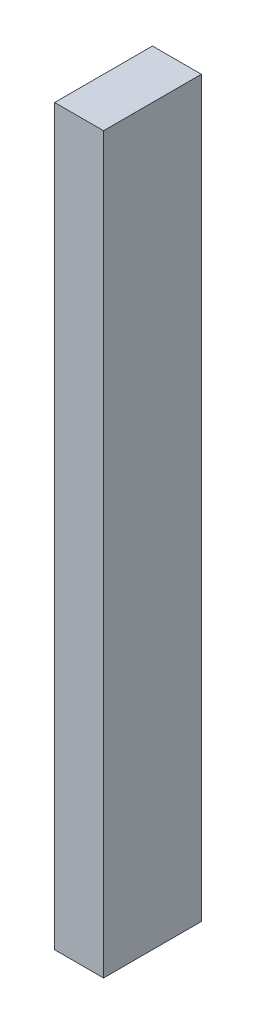
from build123d import *

# Parameters (mm, degrees)
SKETCH1_W           = 50.8
SKETCH1_H           = 101.6
BOSS_EXTRUDE1_DEPTH = 762


with BuildPart() as part:
    # Sketch1 → Boss-Extrude1 (new body)
    with BuildSketch(Plane(origin=(0, 0, 0), x_dir=(1, 0, 0), z_dir=(0, 1, 0))):
        with Locations((25.4, 50.8)):
            Rectangle(SKETCH1_W, SKETCH1_H)
    extrude(amount=BOSS_EXTRUDE1_DEPTH)


solid = part.part
